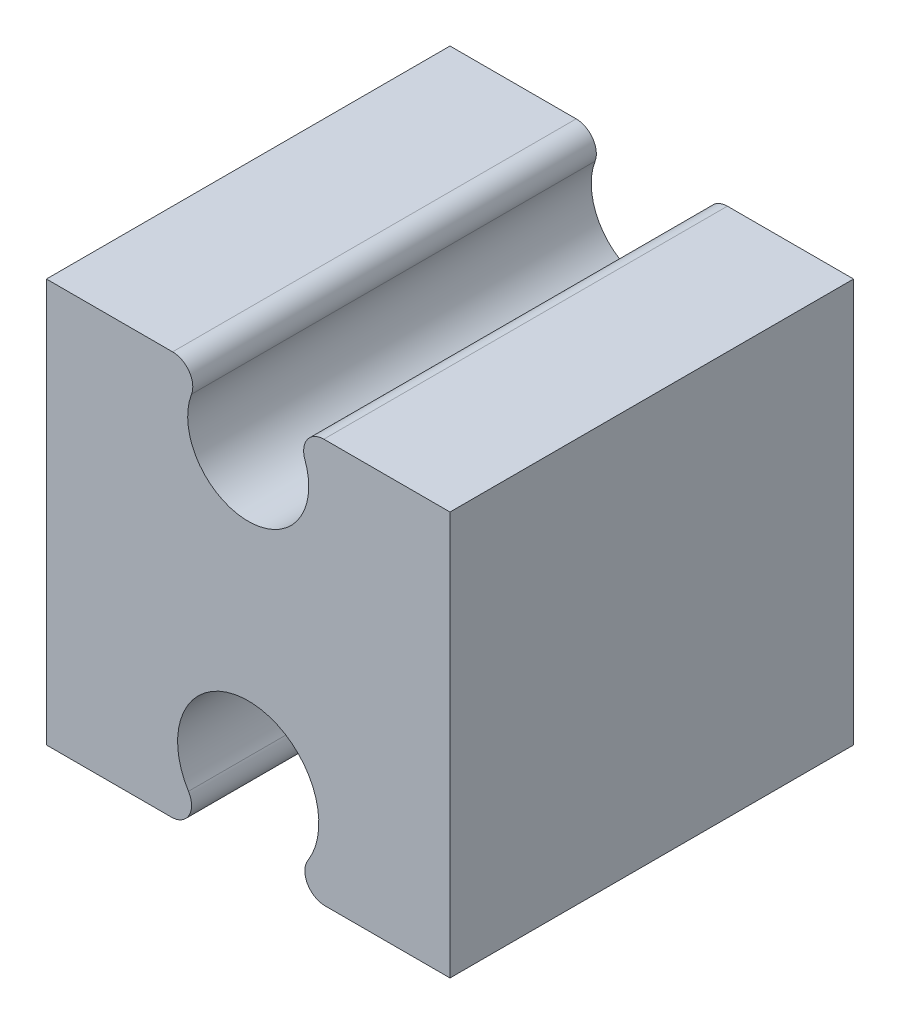
from build123d import *

# Parameters (mm, degrees)
EXTRUDE_1_DEPTH = 10
FILLET_1_R      = 0.5


with BuildPart() as part:
    # 草图1 → 凸台-拉伸1 (new body)
    with BuildSketch(Plane.XY):
        with BuildLine():
            Line((4.1, 0), (0, 0))
            Line((0, 0), (0, -10))
            Line((0, -10), (4.584668807, -10))
            ThreePointArc((4.584668807, -10), (3.919335757, -6.923531768), (6.75, -8.3))
            ThreePointArc((6.75, -8.3), (6.376468232, -9.380664243), (5.415331193, -10))
            Line((5.415331193, -10), (10, -10))
            Line((10, -10), (10, 0))
            Line((10, 0), (5.9, 0))
            ThreePointArc((5.9, 0), (6.341640786, -0.529179607), (6.5, -1.2))
            ThreePointArc((6.5, -1.2), (4.329179607, -2.541640786), (4.1, 0))
        make_face()
    extrude(amount=EXTRUDE_1_DEPTH)

    # 圆角1
    fillet_1_edges = [part.edges().sort_by_distance(p)[0] for p in [
        (4.584668807, -10, 5),
        (4.1, 0, 5),
        (5.9, 0, 5),
        (5.415331193, -10, 5),
    ]]
    fillet(fillet_1_edges, radius=FILLET_1_R)


solid = part.part
